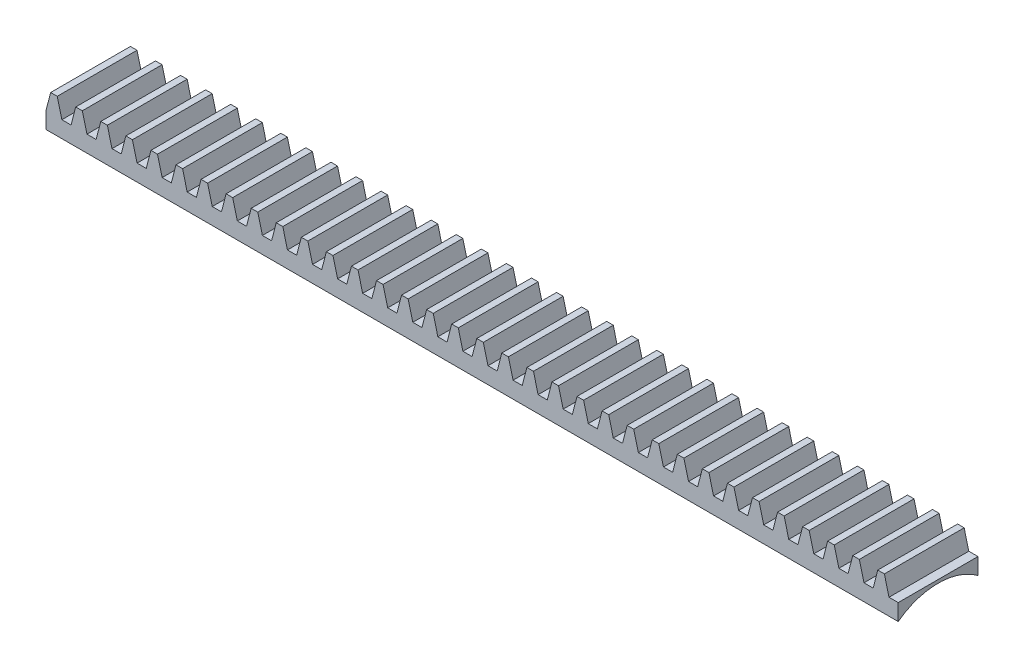
from build123d import *

# Parameters (mm, degrees)
BLANKSKE_W              = 110
BLANKSKE_H              = 11
BLANK_DEPTH             = 10
TOOTHCUTSIM_DEPTH       = 112
TEETHCUTS_COUNT         = 36
TEETHCUTS_PITCH         = 3.14159265
CUT_EXTRUDE1_DEPTH      = 112
CUT_EXTRUDE1_DEPTH_BACK = 112
SKETCH1_R               = 8.35
SKETCH3_W               = 2.609723718
SKETCH3_H               = 4.369414265
CUT_EXTRUDE2_DEPTH      = 10


with BuildPart() as part:
    # BlankSke → Blank (new body)
    with BuildSketch(Plane.XY):
        with Locations((55, 5.5)):
            Rectangle(BLANKSKE_W, BLANKSKE_H)
    extrude(amount=-BLANK_DEPTH)

    # TooCutSkeSim → ToothCutSim (cut, through all)
    with BuildSketch(Plane.XY):
        Polygon((0.576126182, 8.75), (-0.576126182, 8.75), (-1.164584633, 11.0254), (1.164584633, 11.0254), align=None)
    toothcutsim = extrude(amount=-TOOTHCUTSIM_DEPTH, mode=Mode.SUBTRACT)

    # TeethCuts: ToothCutSim ×36
    with Locations(*[(i * TEETHCUTS_PITCH, 0, 0) for i in range(1, TEETHCUTS_COUNT)]):
        add(toothcutsim, mode=Mode.SUBTRACT)

    # Sketch1 → Cut-Extrude1 (cut, two sides: drawn at the far end of the back side and taken through both)
    with BuildSketch(Plane(origin=(110, 0, 0), x_dir=(0, 0, -1), z_dir=(1, 0, 0)).offset(-CUT_EXTRUDE1_DEPTH_BACK)):
        with Locations((5, 0)):
            Circle(SKETCH1_R)
    extrude(amount=CUT_EXTRUDE1_DEPTH + CUT_EXTRUDE1_DEPTH_BACK, mode=Mode.SUBTRACT)

    # Sketch3 → Cut-Extrude2 (cut)
    with BuildSketch(Plane(origin=(0, 0, -10), x_dir=(-1, 0, 0), z_dir=(0, 0, -1))):
        with Locations((-108.695138141, 8.872195451)):
            Rectangle(SKETCH3_W, SKETCH3_H)
        Polygon((-0.576126182, 8.75), (-0.576126182, 11), (0, 11), (0, 6.687488318), (-0.576126182, 6.687488318), align=None)
    extrude(amount=-CUT_EXTRUDE2_DEPTH, mode=Mode.SUBTRACT)


solid = part.part
